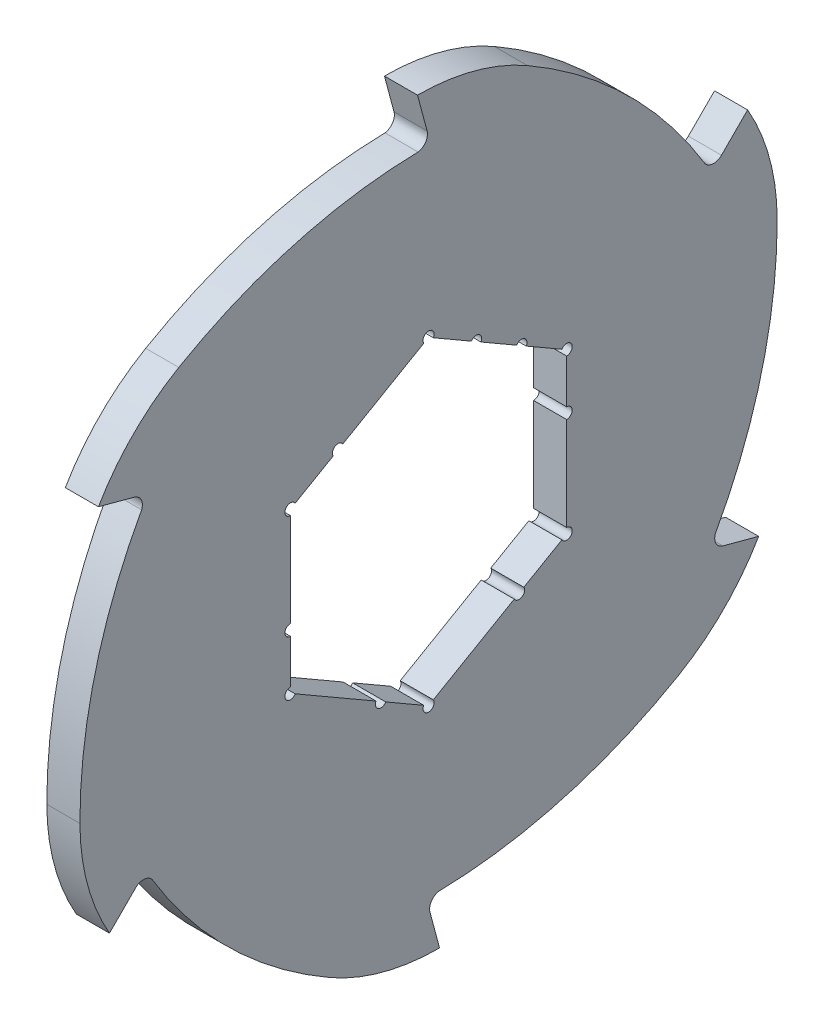
from build123d import *

# Parameters (mm, degrees)
SKETCH1_R                = 59
EXTRUDE1_DEPTH           = 3
EXTRUDE2_DEPTH           = 3
CIRPATTERN1_COUNT        = 6
F_2_0_2_DIAMETER_HOLE1_D = 2
F_2_0_2_DIAMETER_HOLE3_D = 2
F_2_0_2_DIAMETER_HOLE4_D = 2
CIRPATTERN2_COUNT        = 6


with BuildPart() as part:
    # Sketch1 → Extrude1 (new, symmetric)
    with BuildSketch(Plane(origin=(0, 0, 0), x_dir=(0, 0, -1), z_dir=(1, 0, 0))):
        Circle(SKETCH1_R)
        Polygon((25.05, 14.462624243), (0, 28.925248486), (-25.05, 14.462624243), (-25.05, -14.462624243), (0, -28.925248486), (25.05, -14.462624243), align=None, mode=Mode.SUBTRACT)
    extrude(amount=EXTRUDE1_DEPTH, both=True)

    # Sketch2 → Extrude2 (add, symmetric)
    with BuildSketch(Plane(origin=(0, 0, 0), x_dir=(0, 0, -1), z_dir=(1, 0, 0))):
        with BuildLine():
            Line((-2, 67.961805723), (-0.262709442, 61.478149092))
            ThreePointArc((-0.262709442, 61.478149092), (-0.58620663, 59.77173183), (-2.122608272, 58.961805723))
            ThreePointArc((-2.122608272, 58.961805723), (28.679663449, 51.560419941), (51.21368579, 29.294340542))
            ThreePointArc((51.21368579, 29.294340542), (36.791707484, 48.186627241), (17.927108603, 62.644803614))
            ThreePointArc((17.927108603, 62.644803614), (8.312130826, 66.609702921), (-2, 67.961805723))
        make_face()
    extrude2 = extrude(amount=EXTRUDE2_DEPTH, both=True)

    # CirPattern1: Extrude2 ×6 about axis
    cirpattern1_axis = Axis((0, 0, 0), (1, 0, 0))
    for i in range(1, CIRPATTERN1_COUNT):
        add(extrude2.rotate(cirpattern1_axis, i * 360 / CIRPATTERN1_COUNT))

    # Ø2.0 (2) Diameter Hole1 (through all)
    with Locations(Plane(origin=(3, 0, 0), x_dir=(0, 0, -1), z_dir=(1, 0, 0))):
        with Locations((0, 28.925248486), (25.05, 14.462624243), (25.05, -14.462624243), (0, -28.925248486), (-25.05, -14.462624243), (-25.05, 14.462624243)):
            Hole(F_2_0_2_DIAMETER_HOLE1_D / 2)

    # Ø2.0 (2) Diameter Hole3 (through all)
    with Locations(Plane(origin=(3, 0, 0), x_dir=(0, 0, -1), z_dir=(1, 0, 0))):
        with Locations((8.638675135, 23.937707072)):
            f_2_0_2_diameter_hole3 = Hole(F_2_0_2_DIAMETER_HOLE3_D / 2)

    # Ø2.0 (2) Diameter Hole4 (through all)
    with Locations(Plane(origin=(3, 0, 0), x_dir=(0, 0, -1), z_dir=(1, 0, 0))):
        with Locations((16.844337567, 19.200165658)):
            Hole(F_2_0_2_DIAMETER_HOLE4_D / 2)

    # CirPattern2: Ø2.0 (2) Diameter Hole3 ×6 about axis
    cirpattern2_axis = Axis((0, 0, 0), (1, 0, 0))
    for i in range(1, CIRPATTERN2_COUNT):
        add(f_2_0_2_diameter_hole3.rotate(cirpattern2_axis, i * 360 / CIRPATTERN2_COUNT), mode=Mode.SUBTRACT)


solid = part.part
